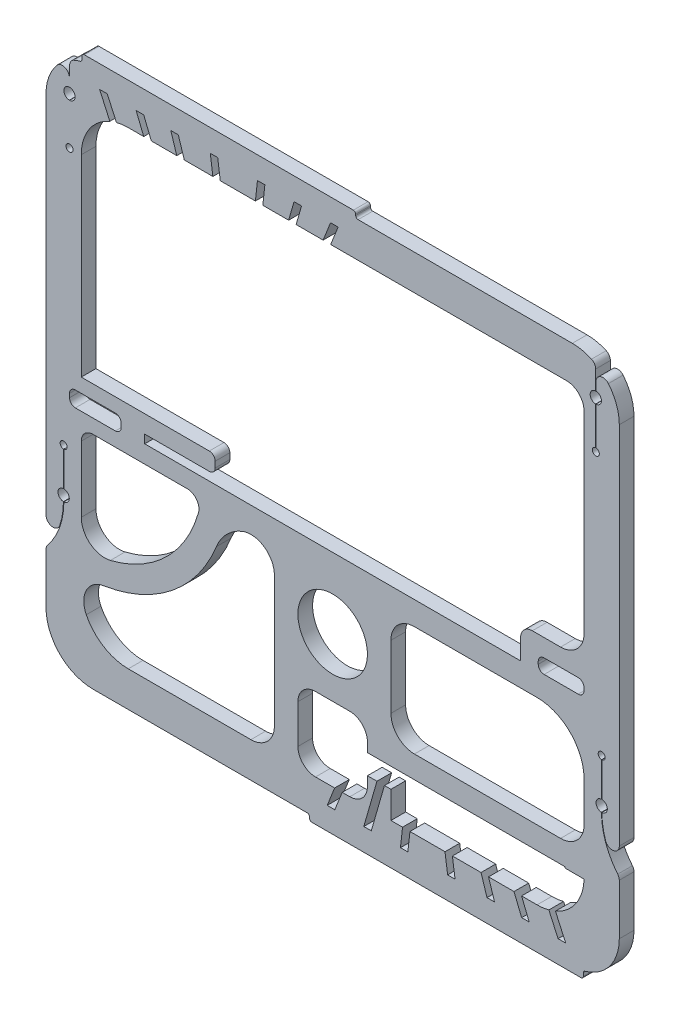
from build123d import *

# Parameters (mm, degrees)
SKETCH1_W              = 61.9766
SKETCH1_H              = 58.2902
SKETCH1_W_2            = 54.3566
SKETCH1_H_2            = 50.6702
BOSS_EXTRUDE1_DEPTH    = 1.5875
BOSS_EXTRUDE2_DEPTH    = 1.5875
BOSS_EXTRUDE3_DEPTH    = 1.5875
FILLET1_R              = 5.08
FILLET2_R              = 5.08
FILLET3_R              = 2.54
SKETCH5_W              = 12.5984
SKETCH5_H              = 19.414025537
BOSS_EXTRUDE4_DEPTH    = 1.5875
SKETCH6_R              = 3.7592
CUT_EXTRUDE2_DEPTH     = 1.5875
SKETCH7_W              = 7.5184
SKETCH7_H              = 7.9996
CUT_EXTRUDE3_DEPTH     = 1.5875
FILLET5_R              = 1.905
SKETCH8_W              = 20.8791
SKETCH8_H              = 2.54
BOSS_EXTRUDE5_DEPTH    = 1.5875
FILLET6_R              = 2.54
CUT_EXTRUDE1_DEPTH     = 1.5875
SKETCH9_R              = 0.6096
CUT_EXTRUDE4_DEPTH     = 1.5875
SLOTS_FOR_CARBON_DEPTH = 64.319991896
FILLET7_R              = 1.905
BOSS_EXTRUDE6_START    = -1.5875
BOSS_EXTRUDE6_DEPTH    = 1.5875
FILLET8_R              = 1.27
SKETCH12_W             = 5.5883
SKETCH12_H             = 1.6764
CUT_EXTRUDE5_DEPTH     = 64.319991896
FILLET9_R              = 0.635
BOSS_EXTRUDE7_START    = -1.5875
BOSS_EXTRUDE7_DEPTH    = 1.5875
FILLET10_R             = 0.254


with BuildPart() as part:
    # Sketch1 → Boss-Extrude1 (new body)
    with BuildSketch(Plane.XY):
        with Locations((20.794942135, -7.260902712)):
            Rectangle(SKETCH1_W, SKETCH1_H)
        with Locations((20.794942135, -7.260902712)):
            Rectangle(SKETCH1_W_2, SKETCH1_H_2, mode=Mode.SUBTRACT)
    extrude(amount=BOSS_EXTRUDE1_DEPTH)

    # Sketch2 → Boss-Extrude2 (add)
    with BuildSketch(Plane(origin=(0, 0, 0), x_dir=(-1, 0, 0), z_dir=(0, 0, -1))):
        with BuildLine():
            Line((-47.973242135, -10.641977175), (-47.973242135, -13.181977175))
            Line((-47.973242135, -13.181977175), (-9.104064582, -13.181977175))
            ThreePointArc((-9.104064582, -13.181977175), (-3.776569969, -22.603905132), (6.383357865, -26.336302712))
            Line((6.383357865, -26.336302712), (6.383357865, -23.796302712))
            ThreePointArc((6.383357865, -23.796302712), (-2.918154924, -19.943489964), (-6.770967672, -10.641977175))
            Line((-6.770967672, -10.641977175), (-47.973242135, -10.641977175))
        make_face()
    extrude(amount=-BOSS_EXTRUDE2_DEPTH)

    # Sketch3 → Boss-Extrude3 (add)
    with BuildSketch(Plane(origin=(0, 0, 0), x_dir=(-1, 0, 0), z_dir=(0, 0, -1))):
        Polygon((-47.973242135, -7.187577175), (-41.114942135, -7.187577175), (-41.114942135, -10.641977175), (-43.019942135, -10.641977175), (-43.019942135, -9.092577175), (-47.973242135, -9.092577175), align=None)
    extrude(amount=-BOSS_EXTRUDE3_DEPTH)

    # Fillet1
    fillet1_edges = [part.edges().sort_by_distance(p)[0] for p in [
        (-10.193357865, 21.884197288, 0.79375),
        (51.783242135, 21.884197288, 0.79375),
        (51.783242135, -36.406002712, 0.79375),
        (-10.193357865, -36.406002712, 0.79375),
    ]]
    fillet(fillet1_edges, radius=FILLET1_R)

    # Fillet2
    fillet2_edges = [part.edges().sort_by_distance(p)[0] for p in [
        (47.973242135, -32.596002712, 0.79375),
        (-6.383357865, 18.074197288, 0.79375),
        (-6.383357865, -32.596002712, 0.79375),
        (6.770967672, -10.641977175, 0.79375),
        (47.973242135, -13.181977175, 0.79375),
        (9.104064582, -13.181977175, 0.79375),
    ]]
    fillet(fillet2_edges, radius=FILLET2_R)

    # Fillet3
    fillet3_edges = [part.edges().sort_by_distance(p)[0] for p in [
        (47.973242135, -7.187577175, 0.79375),
        (-6.383357865, -26.336302712, 0.79375),
        (-6.383357865, -23.796302712, 0.79375),
    ]]
    fillet(fillet3_edges, radius=FILLET3_R)

    # Sketch5 → Boss-Extrude4 (add)
    with BuildSketch(Plane(origin=(0, 0, 0), x_dir=(-1, 0, 0), z_dir=(0, 0, -1))):
        with Locations((-20.794942135, -22.888989944)):
            Rectangle(SKETCH5_W, SKETCH5_H)
    extrude(amount=-BOSS_EXTRUDE4_DEPTH)

    # Sketch6 → Cut-Extrude2 (cut)
    with BuildSketch(Plane(origin=(0, 0, 0), x_dir=(-1, 0, 0), z_dir=(0, 0, -1))):
        with Locations((-20.794942135, -18.297202712)):
            Circle(SKETCH6_R)
    extrude(amount=-CUT_EXTRUDE2_DEPTH, mode=Mode.SUBTRACT)

    # Sketch7 → Cut-Extrude3 (cut)
    with BuildSketch(Plane(origin=(0, 0, 0), x_dir=(-1, 0, 0), z_dir=(0, 0, -1))):
        with Locations((-20.794942135, -28.596202712)):
            Rectangle(SKETCH7_W, SKETCH7_H)
    extrude(amount=-CUT_EXTRUDE3_DEPTH, mode=Mode.SUBTRACT)

    # Fillet5
    fillet5_edges = [part.edges().sort_by_distance(p)[0] for p in [
        (17.035742135, -32.596002712, 0.79375),
        (17.035742135, -24.596402712, 0.79375),
        (24.554142135, -24.596402712, 0.79375),
        (24.554142135, -32.596002712, 0.79375),
    ]]
    fillet(fillet5_edges, radius=FILLET5_R)

    # Sketch8 → Boss-Extrude5 (add)
    with BuildSketch(Plane(origin=(0, 0, 0), x_dir=(-1, 0, 0), z_dir=(0, 0, -1))):
        with Locations((-37.533692135, -26.373002712)):
            Rectangle(SKETCH8_W, SKETCH8_H)
    extrude(amount=-BOSS_EXTRUDE5_DEPTH)

    # Fillet6
    fillet6_edges = [part.edges().sort_by_distance(p)[0] for p in [
        (27.094142135, -13.181977175, 0.79375),
        (14.495742135, -13.181977175, 0.79375),
        (14.495742135, -32.596002712, 0.79375),
        (27.094142135, -25.103002712, 0.79375),
        (47.973242135, -25.103002712, 0.79375),
    ]]
    fillet(fillet6_edges, radius=FILLET6_R)

    # Sketch4 → Cut-Extrude1 (cut)
    with BuildSketch(Plane(origin=(0, 0, 0), x_dir=(-1, 0, 0), z_dir=(0, 0, -1))):
        Polygon((4.328757865, 12.994197288), (4.328757865, 15.153197288), (2.151029411, 15.153197288), (4.398861393, 20.106197288), (3.573759754, 20.106197288), (1.325927772, 15.153197288), (-1.553233214, 15.153197288), (0.45323075, 20.106197288), (-0.36698745, 20.106197288), (-2.373451414, 15.153197288), (-4.870066372, 15.153197288), (-3.295402408, 20.106197288), (-4.108097882, 20.106197288), (-5.682761846, 15.153197288), (-8.250713833, 15.153197288), (-7.565049869, 20.106197288), (-8.367640164, 20.106197288), (-9.053304128, 15.153197288), (-12.118140612, 15.153197288), (-12.66430863, 20.106197288), (-13.466016239, 20.106197288), (-12.919848221, 15.153197288), (-15.196945922, 15.153197288), (-16.61941394, 20.106197288), (-17.429849391, 20.106197288), (-16.007381373, 15.153197288), (-18.609947105, 15.153197288), (-20.565679087, 20.106197288), (-21.384931114, 20.106197288), (-19.429199132, 15.153197288), (-21.325242135, 15.153197288), (-21.325242135, 12.994197288), align=None)
        Polygon((-45.918642135, -27.516002712), (-45.918642135, -29.675002712), (-43.740913681, -29.675002712), (-45.988745663, -34.628002712), (-45.163644024, -34.628002712), (-42.915812042, -29.675002712), (-40.036651056, -29.675002712), (-42.04311502, -34.628002712), (-41.22289682, -34.628002712), (-39.216432856, -29.675002712), (-36.719817899, -29.675002712), (-38.294481863, -34.628002712), (-37.481786388, -34.628002712), (-35.907122424, -29.675002712), (-33.339170437, -29.675002712), (-34.024834401, -34.628002712), (-33.222244106, -34.628002712), (-32.536580142, -29.675002712), (-29.471743658, -29.675002712), (-28.92557564, -34.628002712), (-28.123868031, -34.628002712), (-28.670036049, -29.675002712), (-26.392938349, -29.675002712), (-24.970470331, -34.628002712), (-24.16003488, -34.628002712), (-25.582502898, -29.675002712), (-22.979937166, -29.675002712), (-21.024205184, -34.628002712), (-20.204953157, -34.628002712), (-22.160685139, -29.675002712), (-20.264642135, -29.675002712), (-20.264642135, -27.516002712), align=None)
    extrude(amount=-CUT_EXTRUDE1_DEPTH, mode=Mode.SUBTRACT)

    # Sketch9 → Cut-Extrude4 (cut)
    with BuildSketch(Plane(origin=(0, 0, 0), x_dir=(-1, 0, 0), z_dir=(0, 0, -1))):
        with Locations((-49.243242135, 18.074197288)):
            Circle(SKETCH9_R)
        with Locations((7.653357865, 18.074197288)):
            Circle(SKETCH9_R)
        with Locations((8.288357865, -19.836610396)):
            Circle(SKETCH9_R)
        with Locations((-49.878242135, -19.836610396)):
            Circle(SKETCH9_R)
    extrude(amount=-CUT_EXTRUDE4_DEPTH, mode=Mode.SUBTRACT)

    # Sketch10 → Slots for carbon (cut, through all)
    with BuildSketch(Plane.XY.offset(1.5875)):
        with BuildLine():
            Line((-7.640657865, 18.683664982), (-7.640657865, 20.744862195))
            ThreePointArc((-7.640657865, 20.744862195), (-7.518198688, 21.15914656), (-7.190181394, 21.440273649))
            ThreePointArc((-7.190181394, 21.440273649), (-8.18027088, 20.853943522), (-9.013004924, 20.0598313))
            ThreePointArc((-9.013004924, 20.0598313), (-8.168332682, 20.287856793), (-7.666057865, 19.571486198))
            Line((-7.666057865, 19.571486198), (-7.666057865, 18.683664982))
            ThreePointArc((-7.666057865, 18.683664982), (-7.653357865, 18.683797288), (-7.640657865, 18.683664982))
        make_face()
        with BuildLine():
            Line((-7.640657865, 13.374985563), (-7.640657865, 17.464729594))
            ThreePointArc((-7.640657865, 17.464729594), (-7.653357865, 17.464597288), (-7.666057865, 17.464729594))
            Line((-7.666057865, 17.464729594), (-7.666057865, 13.374985563))
            ThreePointArc((-7.666057865, 13.374985563), (-7.653357865, 12.613197288), (-7.640657865, 13.374985563))
        make_face()
        with BuildLine():
            Line((49.230542135, 18.683664982), (49.230542135, 20.744862195))
            ThreePointArc((49.230542135, 20.744862195), (49.108082958, 21.15914656), (48.780065665, 21.440273649))
            ThreePointArc((48.780065665, 21.440273649), (49.77015515, 20.853943522), (50.602889194, 20.0598313))
            ThreePointArc((50.602889194, 20.0598313), (49.758216952, 20.287856793), (49.255942135, 19.571486198))
            Line((49.255942135, 19.571486198), (49.255942135, 18.683664982))
            ThreePointArc((49.255942135, 18.683664982), (49.243242135, 18.683797288), (49.230542135, 18.683664982))
        make_face()
        with BuildLine():
            Line((49.230542135, 13.374985563), (49.230542135, 17.464729594))
            ThreePointArc((49.230542135, 17.464729594), (49.243242135, 17.464597288), (49.255942135, 17.464729594))
            Line((49.255942135, 17.464729594), (49.255942135, 13.374985563))
            ThreePointArc((49.255942135, 13.374985563), (49.243242135, 12.613197288), (49.230542135, 13.374985563))
        make_face()
        with BuildLine():
            Line((49.890942135, -15.518054639), (49.890942135, -19.227142702))
            ThreePointArc((49.890942135, -19.227142702), (49.878242135, -19.227010396), (49.865542135, -19.227142702))
            Line((49.865542135, -19.227142702), (49.865542135, -15.518054639))
            ThreePointArc((49.865542135, -15.518054639), (49.878242135, -14.756266364), (49.890942135, -15.518054639))
        make_face()
        with BuildLine():
            Line((-8.275657865, -15.518054639), (-8.275657865, -19.227142702))
            ThreePointArc((-8.275657865, -19.227142702), (-8.288357865, -19.227010396), (-8.301057865, -19.227142702))
            Line((-8.301057865, -19.227142702), (-8.301057865, -15.518054639))
            ThreePointArc((-8.301057865, -15.518054639), (-8.288357865, -14.756266364), (-8.275657865, -15.518054639))
        make_face()
        with BuildLine():
            Line((51.783242135, -25.84449226), (51.783242135, -22.638962645))
            ThreePointArc((51.783242135, -22.638962645), (51.143222559, -23.391136013), (50.298295216, -22.879777413))
            ThreePointArc((50.298295216, -22.879777413), (50.002903339, -21.678629064), (49.903642153, -20.445680998))
            ThreePointArc((49.903642153, -20.445680998), (49.878242153, -20.446210396), (49.852842153, -20.445681))
            ThreePointArc((49.852842153, -20.445681), (50.305371488, -23.055911221), (51.610456456, -25.361304426))
            ThreePointArc((51.610456456, -25.361304426), (51.7387466, -25.587916066), (51.783242135, -25.84449226))
        make_face()
        with BuildLine():
            Line((-10.193357865, -22.638962645), (-10.193357865, -25.84449226))
            ThreePointArc((-10.193357865, -25.84449226), (-10.148862329, -25.587916066), (-10.020572186, -25.361304426))
            ThreePointArc((-10.020572186, -25.361304426), (-8.715487218, -23.055911221), (-8.262957883, -20.445681))
            ThreePointArc((-8.262957883, -20.445681), (-8.288357883, -20.446210396), (-8.313757883, -20.445680998))
            ThreePointArc((-8.313757883, -20.445680998), (-8.413019068, -21.678629064), (-8.708410946, -22.879777413))
            ThreePointArc((-8.708410946, -22.879777413), (-9.553338289, -23.391136013), (-10.193357865, -22.638962645))
        make_face()
    extrude(amount=-SLOTS_FOR_CARBON_DEPTH, mode=Mode.SUBTRACT)

    # Fillet7
    fillet7_edges = [part.edges().sort_by_distance(p)[0] for p in [
        (47.973242135, 18.074197288, 0.79375),
    ]]
    fillet(fillet7_edges, radius=FILLET7_R)

    # Sketch11 → Boss-Extrude6 (add)
    with BuildSketch(Plane(origin=(0, 0, 0), x_dir=(-1, 0, 0), z_dir=(0, 0, -1)).offset(BOSS_EXTRUDE6_START)):
        with BuildLine():
            Line((-7.16347052, -12.546977175), (6.383357865, -12.546977175))
            Line((6.383357865, -12.546977175), (6.383357865, -7.822577175))
            Line((6.383357865, -7.822577175), (-8.094942135, -7.822577175))
            Line((-8.094942135, -7.822577175), (-8.094942135, -9.727577175))
            Line((-8.094942135, -9.727577175), (-0.474942135, -9.727577175))
            Line((-0.474942135, -9.727577175), (-0.474942135, -10.641977175))
            Line((-0.474942135, -10.641977175), (-11.129044249, -10.641977175))
            ThreePointArc((-11.129044249, -10.641977175), (-8.929339723, -11.142927055), (-7.16347052, -12.546977175))
        make_face()
    extrude(amount=BOSS_EXTRUDE6_DEPTH)

    # Fillet8
    fillet8_edges = [part.edges().sort_by_distance(p)[0] for p in [
        (41.114942135, -7.187577175, 0.79375),
        (7.16347052, -12.546977175, 0.79375),
        (-6.383357865, -12.546977175, 0.79375),
    ]]
    fillet(fillet8_edges, radius=FILLET8_R)

    # Sketch12 → Cut-Extrude5 (cut, through all)
    with BuildSketch(Plane(origin=(0, 0, 0), x_dir=(-1, 0, 0), z_dir=(0, 0, -1))):
        with Locations((4.859207865, -10.184777175)):
            Rectangle(SKETCH12_W, SKETCH12_H)
    extrude(amount=-CUT_EXTRUDE5_DEPTH, mode=Mode.SUBTRACT)

    # Fillet9
    fillet9_edges = [part.edges().sort_by_distance(p)[0] for p in [
        (47.973242135, -10.641977175, 0.79375),
        (43.019942135, -9.092577175, 0.79375),
        (43.019942135, -10.641977175, 0.79375),
        (47.973242135, -9.092577175, 0.79375),
        (8.094942135, -7.822577175, 0.79375),
        (8.094942135, -9.727577175, 0.79375),
        (-2.065057865, -11.022977175, 0.79375),
        (-2.065057865, -9.346577175, 0.79375),
        (-7.653357865, -9.346577175, 0.79375),
        (-7.653357865, -11.022977175, 0.79375),
    ]]
    fillet(fillet9_edges, radius=FILLET9_R)

    # Sketch13 → Boss-Extrude7 (add)
    with BuildSketch(Plane(origin=(0, 0, 0), x_dir=(-1, 0, 0), z_dir=(0, 0, -1)).offset(BOSS_EXTRUDE7_START)):
        with BuildLine():
            Line((-23.289931114, 21.884197288), (5.113357865, 21.884197288))
            ThreePointArc((5.113357865, 21.884197288), (5.712797553, 21.848706388), (6.303861393, 21.742729595))
            Line((6.303861393, 21.742729595), (6.303861393, 22.519197288))
            Line((6.303861393, 22.519197288), (-23.289931114, 22.519197288))
            Line((-23.289931114, 22.519197288), (-23.289931114, 21.884197288))
        make_face()
        with BuildLine():
            Line((-18.299953157, -36.406002712), (-46.703242135, -36.406002712))
            ThreePointArc((-46.703242135, -36.406002712), (-47.302681823, -36.370511812), (-47.893745663, -36.264535019))
            Line((-47.893745663, -36.264535019), (-47.893745663, -37.041002712))
            Line((-47.893745663, -37.041002712), (-18.299953157, -37.041002712))
            Line((-18.299953157, -37.041002712), (-18.299953157, -36.406002712))
        make_face()
    extrude(amount=BOSS_EXTRUDE7_DEPTH)

    # Fillet10
    fillet10_edges = [part.edges().sort_by_distance(p)[0] for p in [
        (-6.303861393, 21.742729595, 0.79375),
        (-6.303861393, 22.519197288, 0.79375),
        (23.289931114, 22.519197288, 0.79375),
        (23.289931114, 21.884197288, 0.79375),
        (47.893745663, -36.264535019, 0.79375),
        (47.893745663, -37.041002712, 0.79375),
        (18.299953157, -37.041002712, 0.79375),
        (18.299953157, -36.406002712, 0.79375),
    ]]
    fillet(fillet10_edges, radius=FILLET10_R)


solid = part.part
